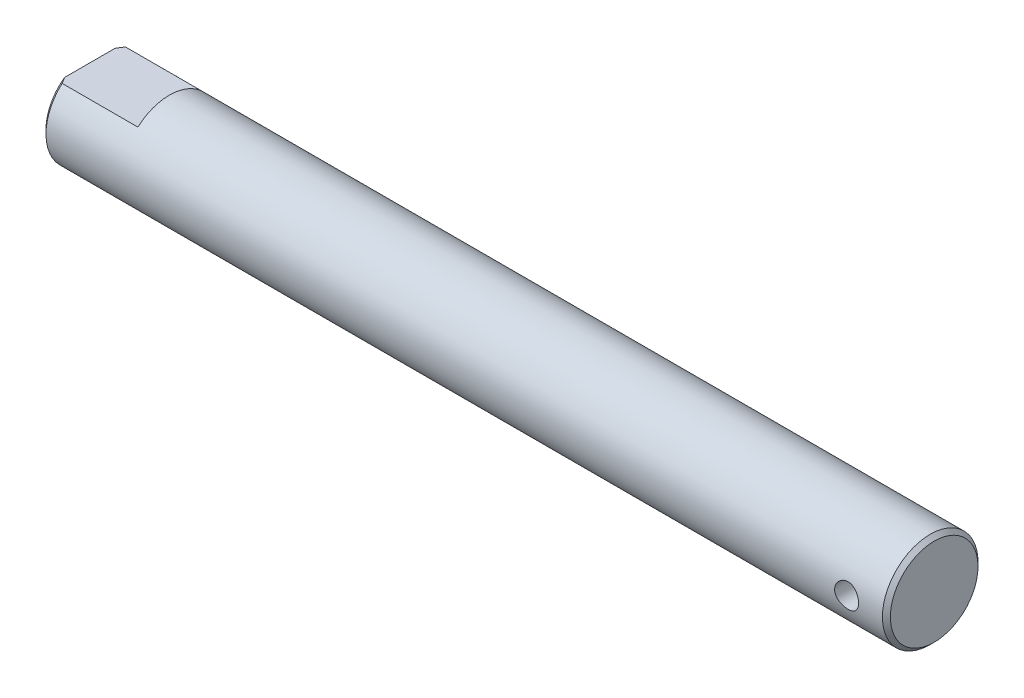
from build123d import *

# Parameters (mm, degrees)
SKETCH1_R               = 6
BOSS_EXTRUDE1_DEPTH     = 106
CHAMFER1_SIZE           = 0.5
SKETCH2_W               = 11.730964961
SKETCH2_H               = 2.709784304
CUT_EXTRUDE1_DEPTH      = 10
CUT_EXTRUDE2_DEPTH      = 107.339080304
CUT_EXTRUDE2_DEPTH_BACK = 107.339080304
SKETCH3_R               = 1.5


with BuildPart() as part:
    # Sketch1 → Boss-Extrude1 (new body)
    with BuildSketch(Plane(origin=(0, 0, 0), x_dir=(0, 0, -1), z_dir=(1, 0, 0))):
        Circle(SKETCH1_R)
    extrude(amount=BOSS_EXTRUDE1_DEPTH)

    # Chamfer1
    chamfer1_edges = [part.edges().sort_by_distance(p)[0] for p in [
        (0, 0, 6),
        (106, 0, 6),
    ]]
    chamfer(chamfer1_edges, length=CHAMFER1_SIZE)

    # Sketch2 → Cut-Extrude1 (cut)
    with BuildSketch(Plane.ZY):
        with Locations((0.102903201, 5.854892152)):
            Rectangle(SKETCH2_W, SKETCH2_H)
    extrude(amount=-CUT_EXTRUDE1_DEPTH, mode=Mode.SUBTRACT)

    # Sketch3 → Cut-Extrude2 (cut, two sides: drawn at the far end of the back side and taken through both)
    with BuildSketch(Plane.XY.offset(-CUT_EXTRUDE2_DEPTH_BACK)):
        with Locations((101, 0)):
            Circle(SKETCH3_R)
    extrude(amount=CUT_EXTRUDE2_DEPTH + CUT_EXTRUDE2_DEPTH_BACK, mode=Mode.SUBTRACT)


solid = part.part
